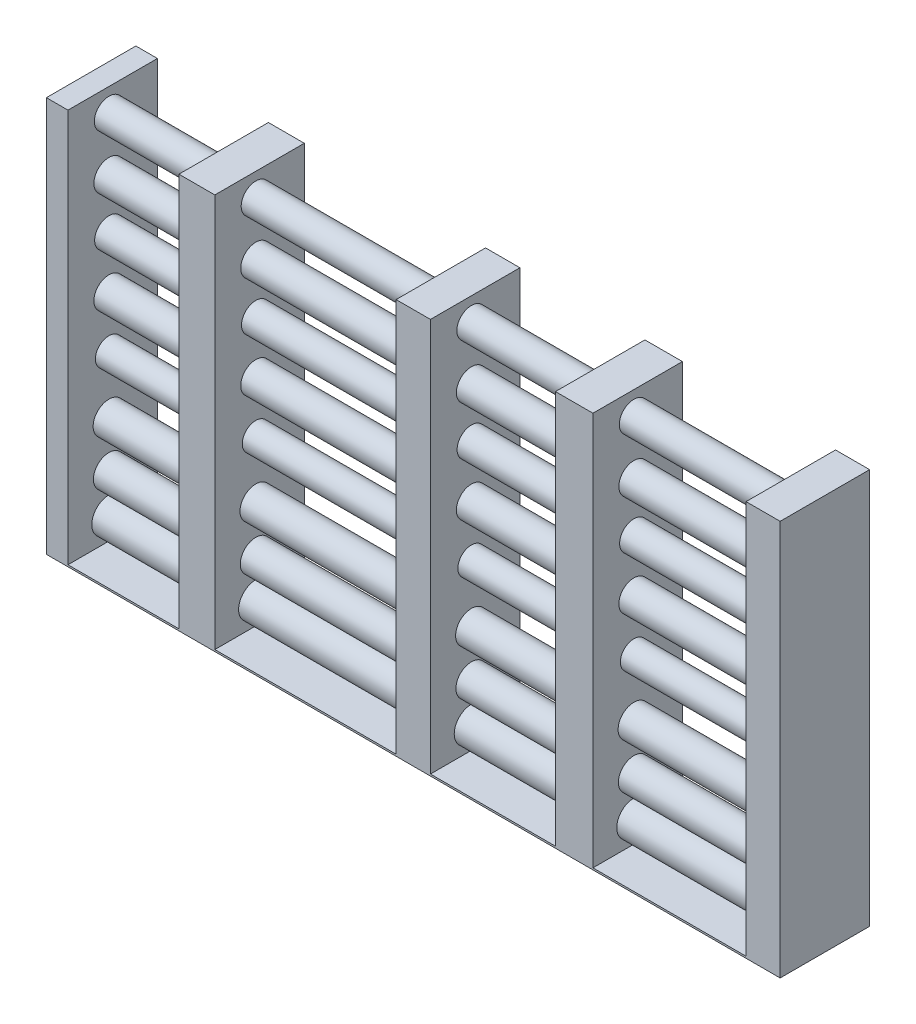
from build123d import *

# Parameters (mm, degrees)
SKETCH1_W             = 2.412698413
SKETCH1_H             = 44
BOSS_EXTRUDE1_DEPTH   = 10
SKETCH1_W_2           = 4.015873015
BOSS_EXTRUDE1_2_DEPTH = 10
SKETCH1_W_3           = 4.19047619
BOSS_EXTRUDE1_3_DEPTH = 10
SKETCH1_W_4           = 3.80952381
BOSS_EXTRUDE1_4_DEPTH = 10
SKETCH1_W_5           = 3.841269842
BOSS_EXTRUDE1_5_DEPTH = 10
SKETCH2_R             = 1.633949522
SKETCH2_R_2           = 1.683053635
SKETCH2_R_3           = 1.598900953
SKETCH2_R_4           = 1.514748271
SKETCH2_R_5           = 1.767206317
SKETCH2_R_6           = 1.734851978
SKETCH2_R_7           = 1.920820677
BOSS_EXTRUDE2_DEPTH   = 79
SKETCH3_W             = 3.415155575
SKETCH3_H             = 9.375258814
CUT_EXTRUDE1_DEPTH    = 43
SKETCH4_W             = 3.285780113
SKETCH4_H             = 9.121325595
CUT_EXTRUDE2_DEPTH    = 43
SKETCH5_W             = 3.071339727
SKETCH5_H             = 9.276276067
CUT_EXTRUDE3_DEPTH    = 43
SKETCH6_W             = 3.446725694
SKETCH6_H             = 9.487027157
CUT_EXTRUDE4_DEPTH    = 43
SKETCH7_W             = 1.989906413
SKETCH7_H             = 9.551550778
CUT_EXTRUDE5_DEPTH    = 43
SKETCH8_W             = 82
SKETCH8_H             = 10
BOSS_EXTRUDE3_DEPTH   = 0.2


with BuildPart() as part:
    # Sketch1 → Boss-Extrude1 (new body)
    with BuildSketch(Plane.XY):
        with Locations((-39.793650793, 0)):
            Rectangle(SKETCH1_W, SKETCH1_H)
    extrude(amount=BOSS_EXTRUDE1_DEPTH)



with BuildPart() as body_2:
    # Sketch1 → Boss-Extrude1 2 (new body)
    with BuildSketch(Plane.XY):
        with Locations((-24.182539682, 0)):
            Rectangle(SKETCH1_W_2, SKETCH1_H)
    extrude(amount=BOSS_EXTRUDE1_2_DEPTH)


with BuildPart() as body_3:
    # Sketch1 → Boss-Extrude1 3 (new body)
    with BuildSketch(Plane.XY):
        with Locations((17.984126984, 0)):
            Rectangle(SKETCH1_W_3, SKETCH1_H)
    extrude(amount=BOSS_EXTRUDE1_3_DEPTH)


with BuildPart() as body_4:
    # Sketch1 → Boss-Extrude1 4 (new body)
    with BuildSketch(Plane.XY):
        with Locations((39.095238095, 0)):
            Rectangle(SKETCH1_W_4, SKETCH1_H)
    extrude(amount=BOSS_EXTRUDE1_4_DEPTH)


with BuildPart() as body_5:
    # Sketch1 → Boss-Extrude1 5 (new body)
    with BuildSketch(Plane.XY):
        Rectangle(SKETCH1_W_5, SKETCH1_H)
    extrude(amount=BOSS_EXTRUDE1_5_DEPTH)


with BuildPart() as part_1:
    add(part.part)

    add(body_2.part)  # Boss-Extrude2 merges body 2

    add(body_3.part)  # Boss-Extrude2 merges body 3

    add(body_4.part)  # Boss-Extrude2 merges body 4

    add(body_5.part)  # Boss-Extrude2 merges body 5
    # Sketch2 → Boss-Extrude2 (add)
    with BuildSketch(Plane(origin=(-38.587301587, 0, 0), x_dir=(0, 0, -1), z_dir=(1, 0, 0))):
        with Locations(Location((-5.420903309, 19.425806282, 0), (0, 0, 180))):
            Circle(SKETCH2_R)
        with Locations(Location((-5.420903309, 13.450965878, 0), (0, 0, 180))):
            Circle(SKETCH2_R_2)
        with Locations(Location((-5.420903309, 7.896888883, 0), (0, 0, 180))):
            Circle(SKETCH2_R_3)
        with Locations(Location((-5.420903309, 2.090353843, 0), (0, 0, 180))):
            Circle(SKETCH2_R_2)
        with Locations(Location((-5.420903309, -3.632028516, 0), (0, 0, 180))):
            Circle(SKETCH2_R_4)
        with Locations(Location((-5.420903309, -10.027632329, 0), (0, 0, 180))):
            Circle(SKETCH2_R_5)
        with Locations(Location((-5.420903309, -15.160945915, 0), (0, 0, 180))):
            Circle(SKETCH2_R_6)
        with Locations(Location((-5.420903309, -19.452732684, 0), (0, 0, 180))):
            Circle(SKETCH2_R_7)
    extrude(amount=BOSS_EXTRUDE2_DEPTH)

    # Sketch3 → Cut-Extrude1 (cut)
    with BuildSketch(Plane.XZ.offset(22)):
        with Locations((39.124547019, 4.970791564)):
            Rectangle(SKETCH3_W, SKETCH3_H)
    extrude(amount=-CUT_EXTRUDE1_DEPTH, mode=Mode.SUBTRACT)

    # Sketch4 → Cut-Extrude2 (cut)
    with BuildSketch(Plane.XZ.offset(22)):
        with Locations((17.868418128, 5.008563078)):
            Rectangle(SKETCH4_W, SKETCH4_H)
    extrude(amount=-CUT_EXTRUDE2_DEPTH, mode=Mode.SUBTRACT)

    # Sketch5 → Cut-Extrude3 (cut)
    with BuildSketch(Plane.XZ.offset(22)):
        with Locations((-0.004150459, 4.964721098)):
            Rectangle(SKETCH5_W, SKETCH5_H)
    extrude(amount=-CUT_EXTRUDE3_DEPTH, mode=Mode.SUBTRACT)

    # Sketch6 → Cut-Extrude4 (cut)
    with BuildSketch(Plane.XZ.offset(22)):
        with Locations((-24.197176497, 4.985015311)):
            Rectangle(SKETCH6_W, SKETCH6_H)
    extrude(amount=-CUT_EXTRUDE4_DEPTH, mode=Mode.SUBTRACT)

    # Sketch7 → Cut-Extrude5 (cut)
    with BuildSketch(Plane.XZ.offset(22)):
        with Locations((-39.773791775, 5.027285399)):
            Rectangle(SKETCH7_W, SKETCH7_H)
    extrude(amount=-CUT_EXTRUDE5_DEPTH, mode=Mode.SUBTRACT)

    # Sketch8 → Boss-Extrude3 (add)
    with BuildSketch(Plane.XZ.offset(22)):
        with Locations((0, 5)):
            Rectangle(SKETCH8_W, SKETCH8_H)
    extrude(amount=BOSS_EXTRUDE3_DEPTH)


solid = part_1.part
